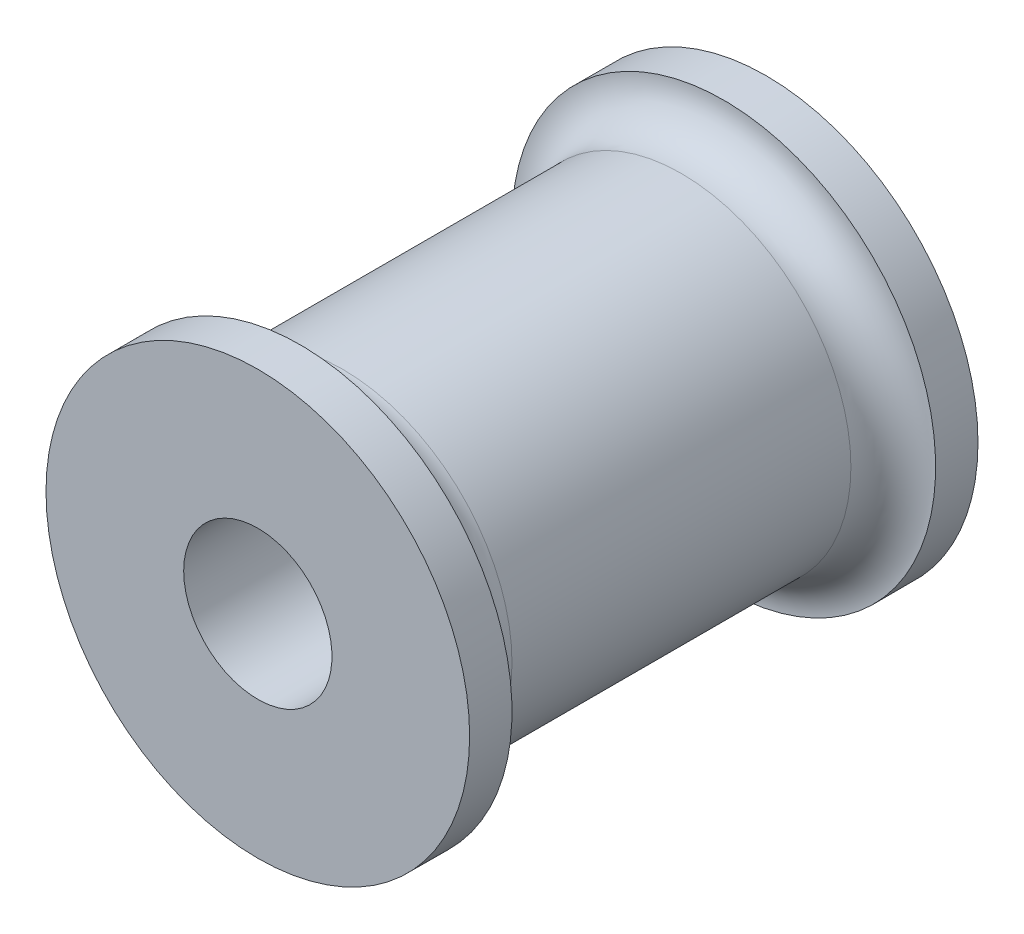
from build123d import *

# Parameters (mm, degrees)
SKETCH1_R           = 10
BOSS_EXTRUDE1_DEPTH = 24
SKETCH3_R           = 3.5
CUT_EXTRUDE1_DEPTH  = 24


with BuildPart() as part:
    # Sketch1 → Boss-Extrude1 (new body)
    with BuildSketch(Plane.XY):
        Circle(SKETCH1_R)
    extrude(amount=BOSS_EXTRUDE1_DEPTH)

    # Sketch2 → Cut-Revolve1 (revolve, cut)
    with BuildSketch(Plane(origin=(0, 0, 0), x_dir=(0, 0, -1), z_dir=(1, 0, 0)), mode=Mode.PRIVATE) as cut_revolve1_sk:
        with BuildLine():
            Line((-22, 10), (-2, 10))
            ThreePointArc((-2, 10), (-2.585786438, 8.585786438), (-4, 8))
            Line((-4, 8), (-20, 8))
            ThreePointArc((-20, 8), (-21.414213562, 8.585786438), (-22, 10))
        make_face()
    revolve(cut_revolve1_sk.sketch.rotate(Axis((0, 0, -0.3), (0, 0, 1)), 90), axis=Axis((0, 0, -0.3), (0, 0, 1)), mode=Mode.SUBTRACT)

    # Sketch3 → Cut-Extrude1 (cut)
    with BuildSketch(Plane(origin=(0, 0, 0), x_dir=(-1, 0, 0), z_dir=(0, 0, -1))):
        Circle(SKETCH3_R)
    extrude(amount=-CUT_EXTRUDE1_DEPTH, mode=Mode.SUBTRACT)


solid = part.part
